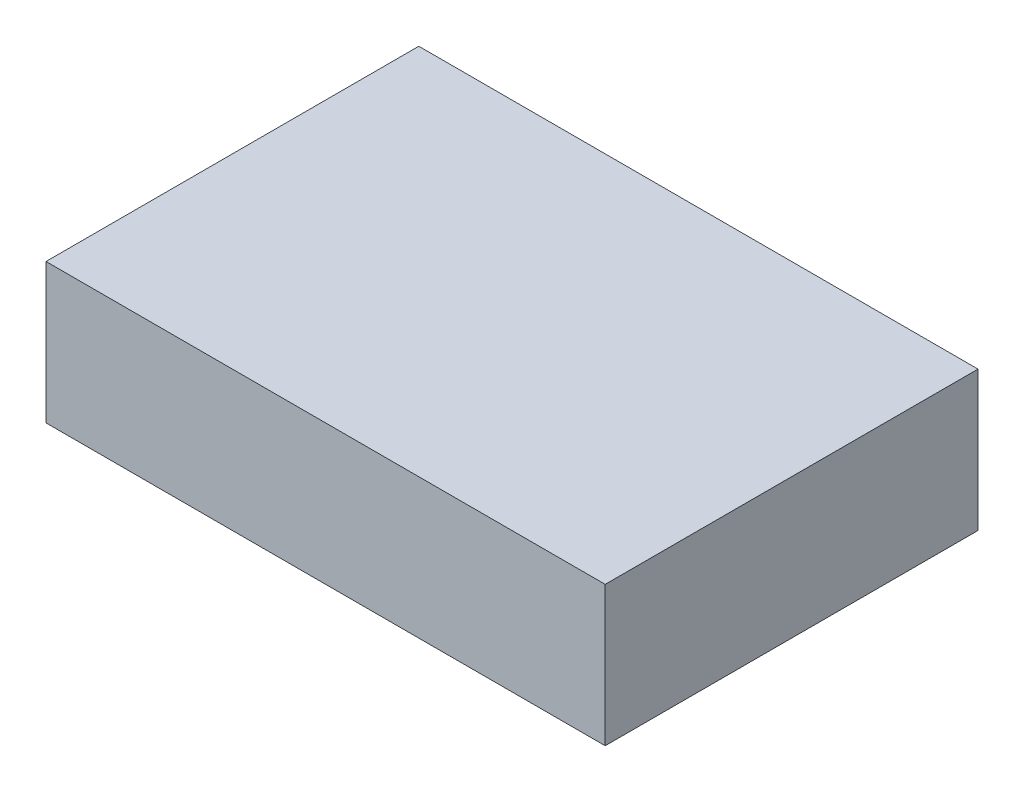
from build123d import *

# Parameters (mm, degrees)
SKETCH1_W           = 120
SKETCH1_H           = 30
BOSS_EXTRUDE1_DEPTH = 80
SHELL1_T            = -5
SKETCH2_R           = 4.17592015
CUT_EXTRUDE1_DEPTH  = 15
LPATTERN1_COUNT     = 4
LPATTERN1_PITCH     = 110


with BuildPart() as part:
    # Sketch1 → Boss-Extrude1 (new body)
    with BuildSketch(Plane.XY):
        with Locations((14.869684499, 8.141289438)):
            Rectangle(SKETCH1_W, SKETCH1_H)
    extrude(amount=BOSS_EXTRUDE1_DEPTH)

    # Shell1
    shell1_openings = [part.faces().sort_by_distance(p)[0] for p in [
        (14.869684499, -6.858710562, 40),
    ]]
    offset(amount=SHELL1_T, openings=shell1_openings, kind=Kind.INTERSECTION)

    # Sketch2 → Cut-Extrude1 (cut)
    with BuildSketch(Plane(origin=(0, 0, 0), x_dir=(-1, 0, 0), z_dir=(0, 0, -1))):
        with Locations((30.130315501, 7.814471991)):
            Circle(SKETCH2_R)
    cut_extrude1 = extrude(amount=-CUT_EXTRUDE1_DEPTH, mode=Mode.SUBTRACT)

    # LPattern1: Cut-Extrude1 ×4
    with Locations(*[(-i * LPATTERN1_PITCH, 0, 0) for i in range(1, LPATTERN1_COUNT)]):
        add(cut_extrude1, mode=Mode.SUBTRACT)


solid = part.part
